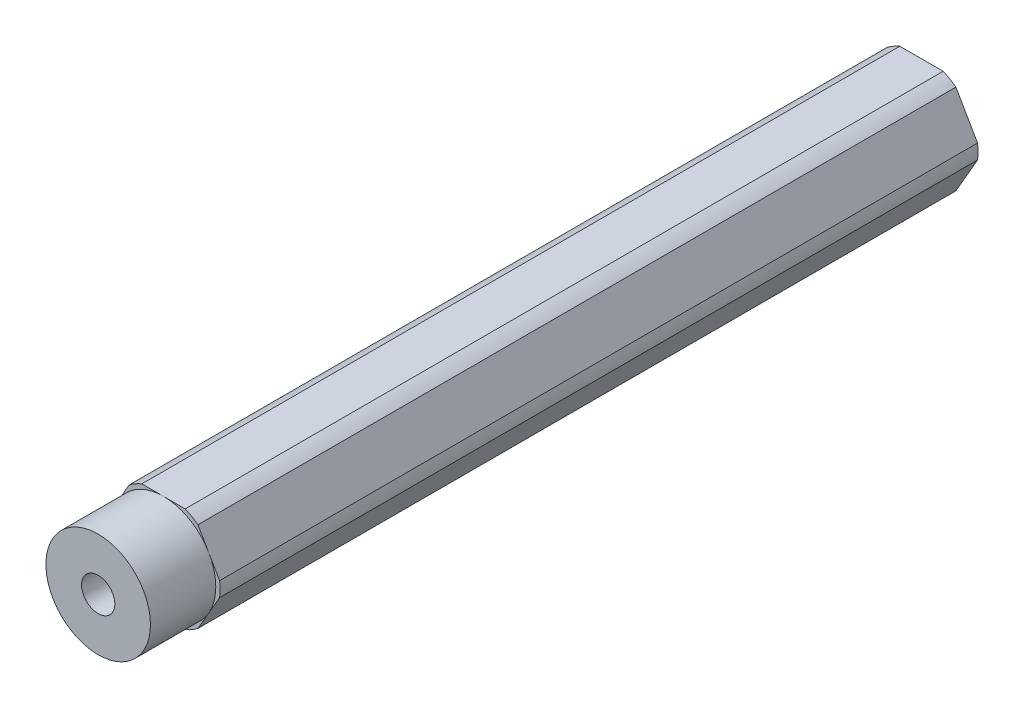
from build123d import *

# Parameters (mm, degrees)
SKETCH1_R           = 2.0193
BOSS_EXTRUDE1_DEPTH = 50.00625
SKETCH2_OUTSIDE_W   = 36.1
SKETCH2_OUTSIDE_H   = 35.05
SKETCH2_OUTSIDE_R   = 6.35
CUT_EXTRUDE2_DEPTH  = 7.9375


with BuildPart() as part:
    # Sketch1 → Boss-Extrude1 (new, symmetric)
    with BuildSketch(Plane.XY):
        with BuildLine():
            ThreePointArc((4.181770846, 5.456960429), (3.437499983, 5.953924622), (2.634980936, 6.35))
            Line((2.634980936, 6.35), (-2.634980936, 6.35))
            ThreePointArc((-2.634980936, 6.35), (-3.437499983, 5.953924622), (-4.181770846, 5.456960429))
            Line((-4.181770846, 5.456960429), (-6.816751782, 0.893039571))
            ThreePointArc((-6.816751782, 0.893039571), (-6.874999966, 0), (-6.816751782, -0.893039571))
            Line((-6.816751782, -0.893039571), (-4.181770846, -5.456960429))
            ThreePointArc((-4.181770846, -5.456960429), (-3.437499983, -5.953924622), (-2.634980936, -6.35))
            Line((-2.634980936, -6.35), (2.634980936, -6.35))
            ThreePointArc((2.634980936, -6.35), (3.437499983, -5.953924622), (4.181770846, -5.456960429))
            Line((4.181770846, -5.456960429), (6.816751782, -0.893039571))
            ThreePointArc((6.816751782, -0.893039571), (6.860422465, -0.447468582), (6.874999966, 0))
            ThreePointArc((6.874999966, 0), (6.860422465, 0.447468582), (6.816751782, 0.893039571))
            Line((6.816751782, 0.893039571), (4.181770846, 5.456960429))
        make_face()
        with Locations(Location((0, 0, 0), (0, 0, 180))):
            Circle(SKETCH1_R, mode=Mode.SUBTRACT)
    extrude(amount=BOSS_EXTRUDE1_DEPTH, both=True)

    # Sketch2 outside → Cut-Extrude2 (cut)
    with BuildSketch(Plane.XY.offset(50.00625)):
        Rectangle(SKETCH2_OUTSIDE_W, SKETCH2_OUTSIDE_H)
        Circle(SKETCH2_OUTSIDE_R, mode=Mode.SUBTRACT)
    extrude(amount=-CUT_EXTRUDE2_DEPTH, mode=Mode.SUBTRACT)


solid = part.part
